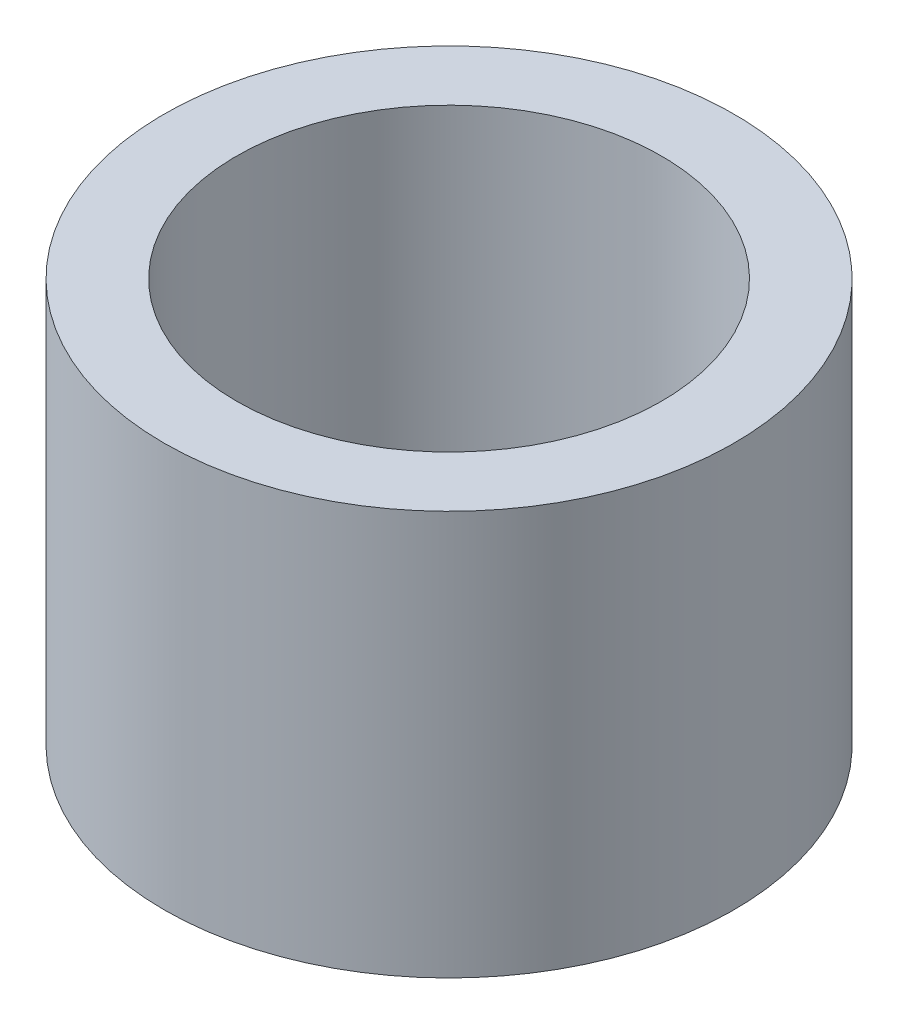
from build123d import *

# Parameters (mm, degrees)
PROFILES_R    = 5.5
PROFILES_R_2  = 4.1
PROFILE_DEPTH = 3.9


with BuildPart() as part:
    # ProfileS → Profile (new, symmetric)
    with BuildSketch(Plane(origin=(0, 0, 0), x_dir=(1, 0, 0), z_dir=(0, 1, 0))):
        with Locations(Location((0, 0, 0), (0, 0, 270))):
            Circle(PROFILES_R)
        with Locations(Location((0, 0, 0), (0, 0, 270))):
            Circle(PROFILES_R_2, mode=Mode.SUBTRACT)
    extrude(amount=PROFILE_DEPTH, both=True)


solid = part.part
